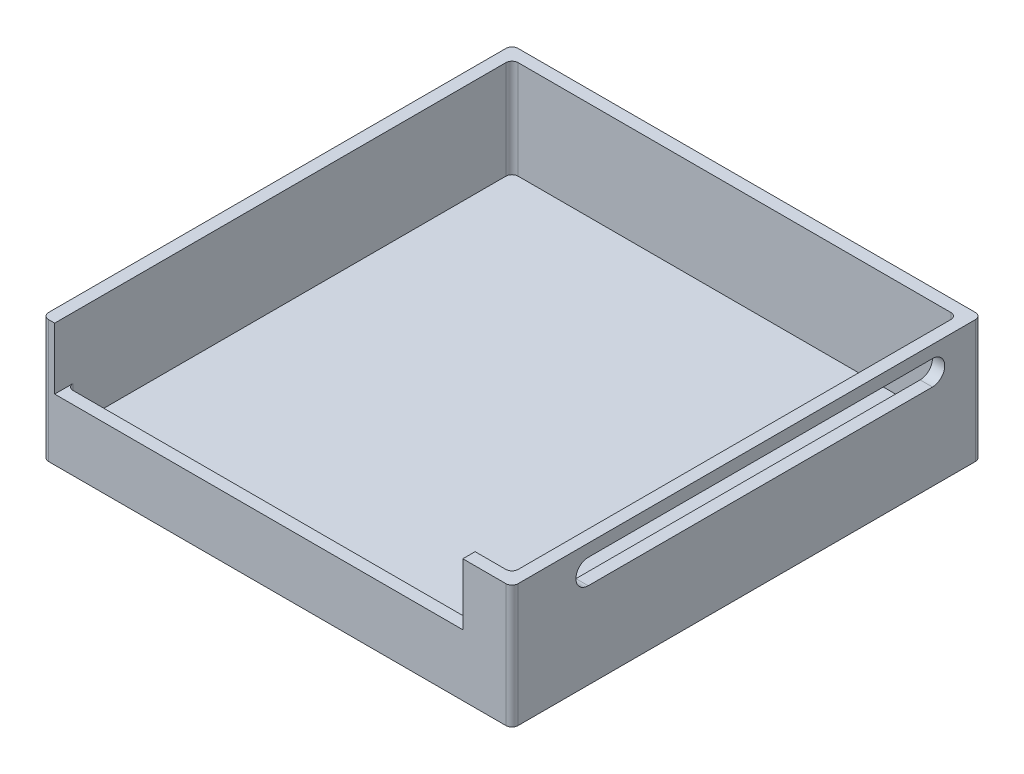
from build123d import *

# Parameters (mm, degrees)
BOSS_EXTRUDE2_DEPTH = 50
BOSS_EXTRUDE3_DEPTH = 10
CUT_EXTRUDE1_DEPTH  = 10
SKETCH4_W           = 140
SKETCH4_H           = 10
CUT_EXTRUDE2_DEPTH  = 10


with BuildPart() as part:
    # Sketch1 → Boss-Extrude2 (new body)
    with BuildSketch(Plane(origin=(0, 0, 0), x_dir=(1, 0, 0), z_dir=(0, 1, 0))):
        with BuildLine():
            Line((-93, 95.5), (93, 95.5))
            ThreePointArc((93, 95.5), (94.767766953, 94.767766953), (95.5, 93))
            Line((95.5, 93), (95.5, -93))
            ThreePointArc((95.5, -93), (94.767766953, -94.767766953), (93, -95.5))
            Line((93, -95.5), (-93, -95.5))
            ThreePointArc((-93, -95.5), (-94.767766953, -94.767766953), (-95.5, -93))
            Line((-95.5, -93), (-95.5, 93))
            ThreePointArc((-95.5, 93), (-94.767766953, 94.767766953), (-93, 95.5))
        make_face()
        with BuildLine():
            Line((-88, 90.5), (88, 90.5))
            ThreePointArc((88, 90.5), (89.767766953, 89.767766953), (90.5, 88))
            Line((90.5, 88), (90.5, -88))
            ThreePointArc((90.5, -88), (89.767766953, -89.767766953), (88, -90.5))
            Line((88, -90.5), (-88, -90.5))
            ThreePointArc((-88, -90.5), (-89.767766953, -89.767766953), (-90.5, -88))
            Line((-90.5, -88), (-90.5, 88))
            ThreePointArc((-90.5, 88), (-89.767766953, 89.767766953), (-88, 90.5))
        make_face(mode=Mode.SUBTRACT)
    extrude(amount=BOSS_EXTRUDE2_DEPTH)

    # Sketch2 → Boss-Extrude3 (add)
    with BuildSketch(Plane(origin=(0, 0, 0), x_dir=(1, 0, 0), z_dir=(0, 1, 0))):
        with BuildLine():
            Line((-88, 90.5), (88, 90.5))
            ThreePointArc((88, 90.5), (89.767766953, 89.767766953), (90.5, 88))
            Line((90.5, 88), (90.5, -88))
            ThreePointArc((90.5, -88), (89.767766953, -89.767766953), (88, -90.5))
            Line((88, -90.5), (-88, -90.5))
            ThreePointArc((-88, -90.5), (-89.767766953, -89.767766953), (-90.5, -88))
            Line((-90.5, -88), (-90.5, 88))
            ThreePointArc((-90.5, 88), (-89.767766953, 89.767766953), (-88, 90.5))
        make_face()
    extrude(amount=BOSS_EXTRUDE3_DEPTH)

    # Sketch3 → Cut-Extrude1 (cut)
    with BuildSketch(Plane.XY.offset(95.5)):
        Polygon((-90.5, 25), (0, 25), (75.5, 25), (75.5, 50), (-90.5, 50), align=None)
    extrude(amount=-CUT_EXTRUDE1_DEPTH, mode=Mode.SUBTRACT)

    # Sketch4 → Cut-Extrude2 (cut)
    with BuildSketch(Plane(origin=(95.5, 0, 0), x_dir=(0, 0, -1), z_dir=(1, 0, 0))):
        with Locations((5.5, 40)):
            Rectangle(SKETCH4_W, SKETCH4_H)
        with BuildLine():
            Line((75.5, 35), (75.5, 45))
            ThreePointArc((75.5, 45), (80.5, 40), (75.5, 35))
        make_face()
        with BuildLine():
            Line((-64.5, 35), (-64.5, 45))
            ThreePointArc((-64.5, 45), (-69.5, 40), (-64.5, 35))
        make_face()
    extrude(amount=-CUT_EXTRUDE2_DEPTH, mode=Mode.SUBTRACT)


solid = part.part
